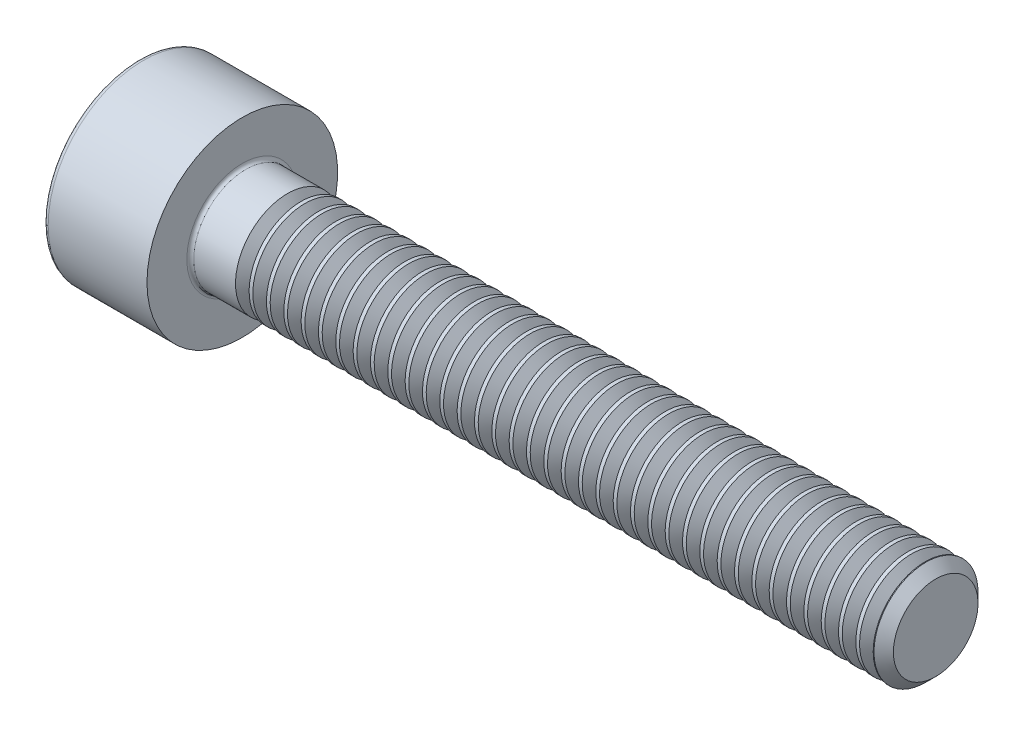
from build123d import *

# Parameters (mm, degrees)
FILLET1_R       = 0.1
FILLET2_R       = 0.15
HEX_2_DEPTH     = 1.3
THDSCHPAT_COUNT = 37
THDSCHPAT_PITCH = 0.5


with BuildPart() as part:
    # BodySke → Base-Revolve (revolve)
    with BuildSketch(Plane.XY, mode=Mode.PRIVATE) as base_revolve_sk:
        Polygon((0, 0), (0, 2.75), (3, 2.75), (3, 1.5), (22.7195, 1.5), (23, 1.2195), (23, 0), align=None)
    revolve(base_revolve_sk.sketch.rotate(Axis((-31.75, 0, 0), (1, 0, 0)), 90), axis=Axis((-31.75, 0, 0), (1, 0, 0)))

    # Fillet1
    fillet1_edges = [part.edges().sort_by_distance(p)[0] for p in [
        (3, 0, -1.5),
    ]]
    fillet(fillet1_edges, radius=FILLET1_R)

    # Fillet2
    fillet2_edges = [part.edges().sort_by_distance(p)[0] for p in [
        (0, 0, -2.75),
    ]]
    fillet(fillet2_edges, radius=FILLET2_R)

    # Sketch2 → Hex-PreBroach (revolve, cut)
    with BuildSketch(Plane.XY, mode=Mode.PRIVATE) as hex_prebroach_sk:
        Polygon((0, 1.28), (1.3, 1.28), (2.039008345, 0), (0, 0), align=None)
    revolve(hex_prebroach_sk.sketch.rotate(Axis((0, 0, 0), (1, 0, 0)), 90), axis=Axis((0, 0, 0), (1, 0, 0)), mode=Mode.SUBTRACT)

    # Sketch3 → Hex 2 (cut)
    with BuildSketch(Plane(origin=(0, 0, 0), x_dir=(0, 0.500000000000001, 0.866025403784438), z_dir=(-1, 0, 0))):
        Polygon((0.739008345, 1.28), (-0.739008345, 1.28), (-1.478016689, 0), (-0.739008345, -1.28), (0.739008345, -1.28), (1.478016689, 0), align=None)
    extrude(amount=-HEX_2_DEPTH, mode=Mode.SUBTRACT)

    # ThdSchSke → ThreadSchematic (revolve, cut)
    with BuildSketch(Plane.XY):
        Polygon((4.5, -1.2195), (4.303591786, -1.5), (4.303591786, -1.875), (4.696408214, -1.875), (4.696408214, -1.5), align=None)
    threadschematic = revolve(axis=Axis((-3.175, 0, 0), (1, 0, 0)), mode=Mode.SUBTRACT)

    # ThdSchPat: ThreadSchematic ×37
    with Locations(*[(i * THDSCHPAT_PITCH, 0, 0) for i in range(1, THDSCHPAT_COUNT)]):
        add(threadschematic, mode=Mode.SUBTRACT)


solid = part.part
